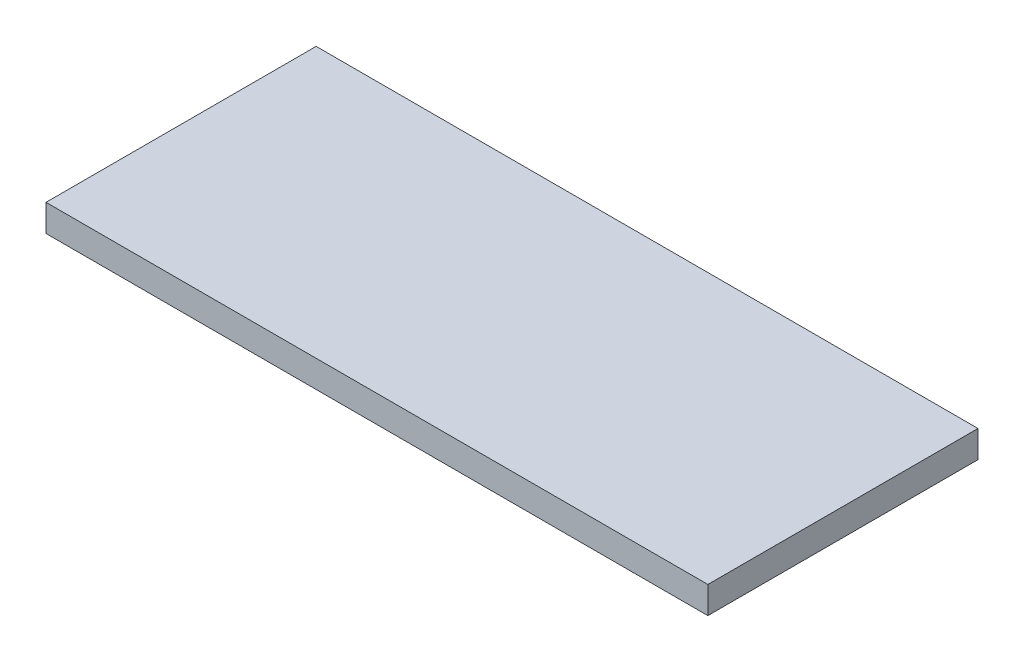
from build123d import *

# Parameters (mm, degrees)
SKETCH1_W           = 62.23
SKETCH1_H           = 25.4
BOSS_EXTRUDE1_DEPTH = 2.54


with BuildPart() as part:
    # Sketch1 → Boss-Extrude1 (new body)
    with BuildSketch(Plane(origin=(0, 0, 0), x_dir=(1, 0, 0), z_dir=(0, 1, 0))):
        Rectangle(SKETCH1_W, SKETCH1_H)
    extrude(amount=BOSS_EXTRUDE1_DEPTH)


solid = part.part
